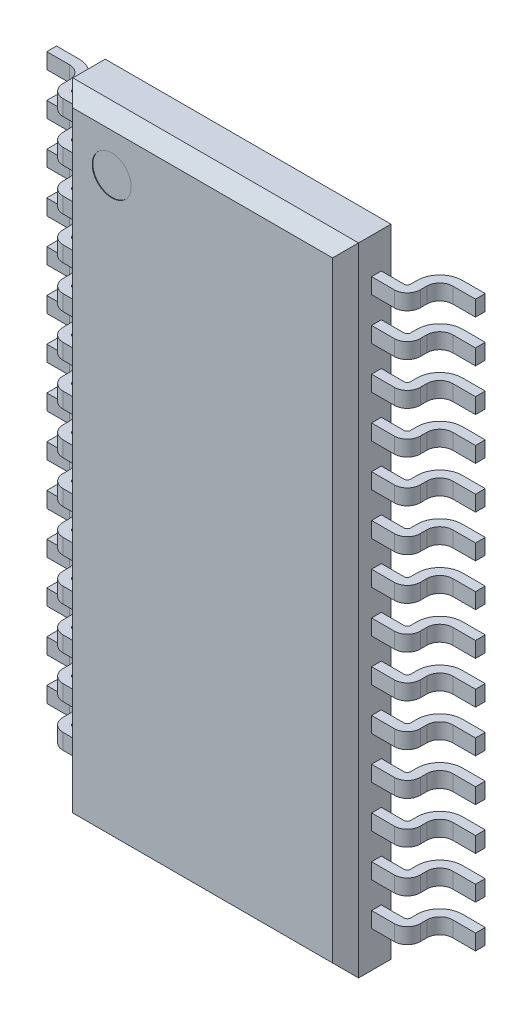
from build123d import *

# Parameters (mm, degrees)
SKETCH_1_W                 = 4.4
SKETCH_1_H                 = 9.8
EXTRUDE_1_DEPTH            = 0.9
CHAMFER_1_SIZE             = 0.2
SKETCH_6_W                 = 0.15
SKETCH_6_H                 = 0.24
PATTERN_LINEAR_1_COUNT     = 8
PATTERN_LINEAR_1_PITCH     = 0.65
PATTERN_LINEAR_1_COL_COUNT = 7
PATTERN_LINEAR_1_COL_PITCH = 0.65
MIRROR_1_COPY_1_SKETCH_W   = 0.15
MIRROR_1_COPY_1_SKETCH_H   = 0.24
MIRROR_1_COPY_2_SKETCH_W   = 0.15
MIRROR_1_COPY_2_SKETCH_H   = 0.24
MIRROR_1_COPY_3_SKETCH_W   = 0.15
MIRROR_1_COPY_3_SKETCH_H   = 0.24
MIRROR_1_COPY_4_SKETCH_W   = 0.15
MIRROR_1_COPY_4_SKETCH_H   = 0.24
MIRROR_1_COPY_5_SKETCH_W   = 0.15
MIRROR_1_COPY_5_SKETCH_H   = 0.24
MIRROR_1_COPY_6_SKETCH_W   = 0.15
MIRROR_1_COPY_6_SKETCH_H   = 0.24
MIRROR_1_COPY_7_SKETCH_W   = 0.15
MIRROR_1_COPY_7_SKETCH_H   = 0.24
MIRROR_1_COPY_8_SKETCH_W   = 0.15
MIRROR_1_COPY_8_SKETCH_H   = 0.24
MIRROR_1_COPY_9_SKETCH_W   = 0.15
MIRROR_1_COPY_9_SKETCH_H   = 0.24
MIRROR_1_COPY_10_SKETCH_W  = 0.15
MIRROR_1_COPY_10_SKETCH_H  = 0.24
MIRROR_1_COPY_11_SKETCH_W  = 0.15
MIRROR_1_COPY_11_SKETCH_H  = 0.24
MIRROR_1_COPY_12_SKETCH_W  = 0.15
MIRROR_1_COPY_12_SKETCH_H  = 0.24
MIRROR_1_COPY_13_SKETCH_W  = 0.15
MIRROR_1_COPY_13_SKETCH_H  = 0.24
SKETCH_7_R                 = 0.3
CUT_EXTRUDE_1_DEPTH        = 0.01


with BuildPart() as part:
    # 草图1 → 拉伸1 (new body)
    with BuildSketch(Plane.XY.offset(0.15)):
        Rectangle(SKETCH_1_W, SKETCH_1_H)
    extrude(amount=EXTRUDE_1_DEPTH)

    # 倒角1
    chamfer_1_edges = [part.edges().sort_by_distance(p)[0] for p in [
        (2.2, 0, 1.05),
        (0, 4.9, 1.05),
        (-2.2, 0, 1.05),
        (0, 4.9, 0.15),
        (2.2, 0, 0.15),
        (0, -4.9, 0.15),
        (-2.2, 0, 0.15),
        (0, -4.9, 1.05),
    ]]
    chamfer(chamfer_1_edges, length=CHAMFER_1_SIZE)

    # 扫描1: sweep along a path in 草图5
    with BuildLine(Plane(origin=(0, 0.33, 0), x_dir=(1, 0, 0), z_dir=(0, 1, 0))) as sweep_1_path:
        Line((-2.2, -0.65), (-2.55, -0.65))
        ThreePointArc((-2.55, -0.65), (-2.691421356, -0.591421356), (-2.75, -0.45))
        Line((-2.75, -0.45), (-2.75, -0.35))
        ThreePointArc((-2.75, -0.35), (-2.808578644, -0.208578644), (-2.95, -0.15))
        Line((-2.95, -0.15), (-3.3, -0.15))
    # 草图6 → 扫描1 (sweep)
    with BuildSketch(Plane(origin=(-2.2, 0, 0), x_dir=(0, 0, -1), z_dir=(1, 0, 0))):
        with Locations((-0.575, 0.33)):
            Rectangle(SKETCH_6_W, SKETCH_6_H)
    sweep_1 = sweep(path=sweep_1_path.line)

    # 阵列(线性)1: 扫描1 ×8
    with Locations(*[(0, -i * PATTERN_LINEAR_1_PITCH, 0) for i in range(1, PATTERN_LINEAR_1_COUNT)]):
        add(sweep_1)

    # 阵列(线性)1 col: 扫描1 ×7
    with Locations(*[(0, i * PATTERN_LINEAR_1_COL_PITCH, 0) for i in range(1, PATTERN_LINEAR_1_COL_COUNT)]):
        add(sweep_1)

    # 镜向1: 扫描1 across plane
    add(sweep_1.mirror(Plane(origin=(0, 0, 0), x_dir=(0, 0, 1), z_dir=(1, 0, 0))))

    # 镜向1 copy 1: sweep along a path in 镜向1 copy 1 path
    with BuildLine(Plane(origin=(0, -0.32, 0), x_dir=(-1, 0, 0), z_dir=(0, 1, 0))) as mirror_1_copy_1_path:
        Line((-2.2, 0.65), (-2.55, 0.65))
        ThreePointArc((-2.55, 0.65), (-2.691421356, 0.591421356), (-2.75, 0.45))
        Line((-2.75, 0.45), (-2.75, 0.35))
        ThreePointArc((-2.75, 0.35), (-2.808578644, 0.208578644), (-2.95, 0.15))
        Line((-2.95, 0.15), (-3.3, 0.15))
    # 镜向1 copy 1 sketch → 镜向1 copy 1 (sweep)
    with BuildSketch(Plane(origin=(2.2, -0.65, 0), x_dir=(0, 0, -1), z_dir=(-1, 0, 0))):
        with Locations((-0.575, -0.33)):
            Rectangle(MIRROR_1_COPY_1_SKETCH_W, MIRROR_1_COPY_1_SKETCH_H)
    sweep(path=mirror_1_copy_1_path.line)

    # 镜向1 copy 2: sweep along a path in 镜向1 copy 2 path
    with BuildLine(Plane(origin=(0, -0.97, 0), x_dir=(-1, 0, 0), z_dir=(0, 1, 0))) as mirror_1_copy_2_path:
        Line((-2.2, 0.65), (-2.55, 0.65))
        ThreePointArc((-2.55, 0.65), (-2.691421356, 0.591421356), (-2.75, 0.45))
        Line((-2.75, 0.45), (-2.75, 0.35))
        ThreePointArc((-2.75, 0.35), (-2.808578644, 0.208578644), (-2.95, 0.15))
        Line((-2.95, 0.15), (-3.3, 0.15))
    # 镜向1 copy 2 sketch → 镜向1 copy 2 (sweep)
    with BuildSketch(Plane(origin=(2.2, -1.3, 0), x_dir=(0, 0, -1), z_dir=(-1, 0, 0))):
        with Locations((-0.575, -0.33)):
            Rectangle(MIRROR_1_COPY_2_SKETCH_W, MIRROR_1_COPY_2_SKETCH_H)
    sweep(path=mirror_1_copy_2_path.line)

    # 镜向1 copy 3: sweep along a path in 镜向1 copy 3 path
    with BuildLine(Plane(origin=(0, -1.62, 0), x_dir=(-1, 0, 0), z_dir=(0, 1, 0))) as mirror_1_copy_3_path:
        Line((-2.2, 0.65), (-2.55, 0.65))
        ThreePointArc((-2.55, 0.65), (-2.691421356, 0.591421356), (-2.75, 0.45))
        Line((-2.75, 0.45), (-2.75, 0.35))
        ThreePointArc((-2.75, 0.35), (-2.808578644, 0.208578644), (-2.95, 0.15))
        Line((-2.95, 0.15), (-3.3, 0.15))
    # 镜向1 copy 3 sketch → 镜向1 copy 3 (sweep)
    with BuildSketch(Plane(origin=(2.2, -1.95, 0), x_dir=(0, 0, -1), z_dir=(-1, 0, 0))):
        with Locations((-0.575, -0.33)):
            Rectangle(MIRROR_1_COPY_3_SKETCH_W, MIRROR_1_COPY_3_SKETCH_H)
    sweep(path=mirror_1_copy_3_path.line)

    # 镜向1 copy 4: sweep along a path in 镜向1 copy 4 path
    with BuildLine(Plane(origin=(0, -2.27, 0), x_dir=(-1, 0, 0), z_dir=(0, 1, 0))) as mirror_1_copy_4_path:
        Line((-2.2, 0.65), (-2.55, 0.65))
        ThreePointArc((-2.55, 0.65), (-2.691421356, 0.591421356), (-2.75, 0.45))
        Line((-2.75, 0.45), (-2.75, 0.35))
        ThreePointArc((-2.75, 0.35), (-2.808578644, 0.208578644), (-2.95, 0.15))
        Line((-2.95, 0.15), (-3.3, 0.15))
    # 镜向1 copy 4 sketch → 镜向1 copy 4 (sweep)
    with BuildSketch(Plane(origin=(2.2, -2.6, 0), x_dir=(0, 0, -1), z_dir=(-1, 0, 0))):
        with Locations((-0.575, -0.33)):
            Rectangle(MIRROR_1_COPY_4_SKETCH_W, MIRROR_1_COPY_4_SKETCH_H)
    sweep(path=mirror_1_copy_4_path.line)

    # 镜向1 copy 5: sweep along a path in 镜向1 copy 5 path
    with BuildLine(Plane(origin=(0, -2.92, 0), x_dir=(-1, 0, 0), z_dir=(0, 1, 0))) as mirror_1_copy_5_path:
        Line((-2.2, 0.65), (-2.55, 0.65))
        ThreePointArc((-2.55, 0.65), (-2.691421356, 0.591421356), (-2.75, 0.45))
        Line((-2.75, 0.45), (-2.75, 0.35))
        ThreePointArc((-2.75, 0.35), (-2.808578644, 0.208578644), (-2.95, 0.15))
        Line((-2.95, 0.15), (-3.3, 0.15))
    # 镜向1 copy 5 sketch → 镜向1 copy 5 (sweep)
    with BuildSketch(Plane(origin=(2.2, -3.25, 0), x_dir=(0, 0, -1), z_dir=(-1, 0, 0))):
        with Locations((-0.575, -0.33)):
            Rectangle(MIRROR_1_COPY_5_SKETCH_W, MIRROR_1_COPY_5_SKETCH_H)
    sweep(path=mirror_1_copy_5_path.line)

    # 镜向1 copy 6: sweep along a path in 镜向1 copy 6 path
    with BuildLine(Plane(origin=(0, -3.57, 0), x_dir=(-1, 0, 0), z_dir=(0, 1, 0))) as mirror_1_copy_6_path:
        Line((-2.2, 0.65), (-2.55, 0.65))
        ThreePointArc((-2.55, 0.65), (-2.691421356, 0.591421356), (-2.75, 0.45))
        Line((-2.75, 0.45), (-2.75, 0.35))
        ThreePointArc((-2.75, 0.35), (-2.808578644, 0.208578644), (-2.95, 0.15))
        Line((-2.95, 0.15), (-3.3, 0.15))
    # 镜向1 copy 6 sketch → 镜向1 copy 6 (sweep)
    with BuildSketch(Plane(origin=(2.2, -3.9, 0), x_dir=(0, 0, -1), z_dir=(-1, 0, 0))):
        with Locations((-0.575, -0.33)):
            Rectangle(MIRROR_1_COPY_6_SKETCH_W, MIRROR_1_COPY_6_SKETCH_H)
    sweep(path=mirror_1_copy_6_path.line)

    # 镜向1 copy 7: sweep along a path in 镜向1 copy 7 path
    with BuildLine(Plane(origin=(0, -4.22, 0), x_dir=(-1, 0, 0), z_dir=(0, 1, 0))) as mirror_1_copy_7_path:
        Line((-2.2, 0.65), (-2.55, 0.65))
        ThreePointArc((-2.55, 0.65), (-2.691421356, 0.591421356), (-2.75, 0.45))
        Line((-2.75, 0.45), (-2.75, 0.35))
        ThreePointArc((-2.75, 0.35), (-2.808578644, 0.208578644), (-2.95, 0.15))
        Line((-2.95, 0.15), (-3.3, 0.15))
    # 镜向1 copy 7 sketch → 镜向1 copy 7 (sweep)
    with BuildSketch(Plane(origin=(2.2, -4.55, 0), x_dir=(0, 0, -1), z_dir=(-1, 0, 0))):
        with Locations((-0.575, -0.33)):
            Rectangle(MIRROR_1_COPY_7_SKETCH_W, MIRROR_1_COPY_7_SKETCH_H)
    sweep(path=mirror_1_copy_7_path.line)

    # 镜向1 copy 8: sweep along a path in 镜向1 copy 8 path
    with BuildLine(Plane(origin=(0, 0.98, 0), x_dir=(-1, 0, 0), z_dir=(0, 1, 0))) as mirror_1_copy_8_path:
        Line((-2.2, 0.65), (-2.55, 0.65))
        ThreePointArc((-2.55, 0.65), (-2.691421356, 0.591421356), (-2.75, 0.45))
        Line((-2.75, 0.45), (-2.75, 0.35))
        ThreePointArc((-2.75, 0.35), (-2.808578644, 0.208578644), (-2.95, 0.15))
        Line((-2.95, 0.15), (-3.3, 0.15))
    # 镜向1 copy 8 sketch → 镜向1 copy 8 (sweep)
    with BuildSketch(Plane(origin=(2.2, 0.65, 0), x_dir=(0, 0, -1), z_dir=(-1, 0, 0))):
        with Locations((-0.575, -0.33)):
            Rectangle(MIRROR_1_COPY_8_SKETCH_W, MIRROR_1_COPY_8_SKETCH_H)
    sweep(path=mirror_1_copy_8_path.line)

    # 镜向1 copy 9: sweep along a path in 镜向1 copy 9 path
    with BuildLine(Plane(origin=(0, 1.63, 0), x_dir=(-1, 0, 0), z_dir=(0, 1, 0))) as mirror_1_copy_9_path:
        Line((-2.2, 0.65), (-2.55, 0.65))
        ThreePointArc((-2.55, 0.65), (-2.691421356, 0.591421356), (-2.75, 0.45))
        Line((-2.75, 0.45), (-2.75, 0.35))
        ThreePointArc((-2.75, 0.35), (-2.808578644, 0.208578644), (-2.95, 0.15))
        Line((-2.95, 0.15), (-3.3, 0.15))
    # 镜向1 copy 9 sketch → 镜向1 copy 9 (sweep)
    with BuildSketch(Plane(origin=(2.2, 1.3, 0), x_dir=(0, 0, -1), z_dir=(-1, 0, 0))):
        with Locations((-0.575, -0.33)):
            Rectangle(MIRROR_1_COPY_9_SKETCH_W, MIRROR_1_COPY_9_SKETCH_H)
    sweep(path=mirror_1_copy_9_path.line)

    # 镜向1 copy 10: sweep along a path in 镜向1 copy 10 path
    with BuildLine(Plane(origin=(0, 2.28, 0), x_dir=(-1, 0, 0), z_dir=(0, 1, 0))) as mirror_1_copy_10_path:
        Line((-2.2, 0.65), (-2.55, 0.65))
        ThreePointArc((-2.55, 0.65), (-2.691421356, 0.591421356), (-2.75, 0.45))
        Line((-2.75, 0.45), (-2.75, 0.35))
        ThreePointArc((-2.75, 0.35), (-2.808578644, 0.208578644), (-2.95, 0.15))
        Line((-2.95, 0.15), (-3.3, 0.15))
    # 镜向1 copy 10 sketch → 镜向1 copy 10 (sweep)
    with BuildSketch(Plane(origin=(2.2, 1.95, 0), x_dir=(0, 0, -1), z_dir=(-1, 0, 0))):
        with Locations((-0.575, -0.33)):
            Rectangle(MIRROR_1_COPY_10_SKETCH_W, MIRROR_1_COPY_10_SKETCH_H)
    sweep(path=mirror_1_copy_10_path.line)

    # 镜向1 copy 11: sweep along a path in 镜向1 copy 11 path
    with BuildLine(Plane(origin=(0, 2.93, 0), x_dir=(-1, 0, 0), z_dir=(0, 1, 0))) as mirror_1_copy_11_path:
        Line((-2.2, 0.65), (-2.55, 0.65))
        ThreePointArc((-2.55, 0.65), (-2.691421356, 0.591421356), (-2.75, 0.45))
        Line((-2.75, 0.45), (-2.75, 0.35))
        ThreePointArc((-2.75, 0.35), (-2.808578644, 0.208578644), (-2.95, 0.15))
        Line((-2.95, 0.15), (-3.3, 0.15))
    # 镜向1 copy 11 sketch → 镜向1 copy 11 (sweep)
    with BuildSketch(Plane(origin=(2.2, 2.6, 0), x_dir=(0, 0, -1), z_dir=(-1, 0, 0))):
        with Locations((-0.575, -0.33)):
            Rectangle(MIRROR_1_COPY_11_SKETCH_W, MIRROR_1_COPY_11_SKETCH_H)
    sweep(path=mirror_1_copy_11_path.line)

    # 镜向1 copy 12: sweep along a path in 镜向1 copy 12 path
    with BuildLine(Plane(origin=(0, 3.58, 0), x_dir=(-1, 0, 0), z_dir=(0, 1, 0))) as mirror_1_copy_12_path:
        Line((-2.2, 0.65), (-2.55, 0.65))
        ThreePointArc((-2.55, 0.65), (-2.691421356, 0.591421356), (-2.75, 0.45))
        Line((-2.75, 0.45), (-2.75, 0.35))
        ThreePointArc((-2.75, 0.35), (-2.808578644, 0.208578644), (-2.95, 0.15))
        Line((-2.95, 0.15), (-3.3, 0.15))
    # 镜向1 copy 12 sketch → 镜向1 copy 12 (sweep)
    with BuildSketch(Plane(origin=(2.2, 3.25, 0), x_dir=(0, 0, -1), z_dir=(-1, 0, 0))):
        with Locations((-0.575, -0.33)):
            Rectangle(MIRROR_1_COPY_12_SKETCH_W, MIRROR_1_COPY_12_SKETCH_H)
    sweep(path=mirror_1_copy_12_path.line)

    # 镜向1 copy 13: sweep along a path in 镜向1 copy 13 path
    with BuildLine(Plane(origin=(0, 4.23, 0), x_dir=(-1, 0, 0), z_dir=(0, 1, 0))) as mirror_1_copy_13_path:
        Line((-2.2, 0.65), (-2.55, 0.65))
        ThreePointArc((-2.55, 0.65), (-2.691421356, 0.591421356), (-2.75, 0.45))
        Line((-2.75, 0.45), (-2.75, 0.35))
        ThreePointArc((-2.75, 0.35), (-2.808578644, 0.208578644), (-2.95, 0.15))
        Line((-2.95, 0.15), (-3.3, 0.15))
    # 镜向1 copy 13 sketch → 镜向1 copy 13 (sweep)
    with BuildSketch(Plane(origin=(2.2, 3.9, 0), x_dir=(0, 0, -1), z_dir=(-1, 0, 0))):
        with Locations((-0.575, -0.33)):
            Rectangle(MIRROR_1_COPY_13_SKETCH_W, MIRROR_1_COPY_13_SKETCH_H)
    sweep(path=mirror_1_copy_13_path.line)

    # 草图7 → 切除-拉伸1 (cut)
    with BuildSketch(Plane.XY.offset(1.05)):
        with Locations((-1.4, 4.1)):
            Circle(SKETCH_7_R)
    extrude(amount=-CUT_EXTRUDE_1_DEPTH, mode=Mode.SUBTRACT)


solid = part.part
